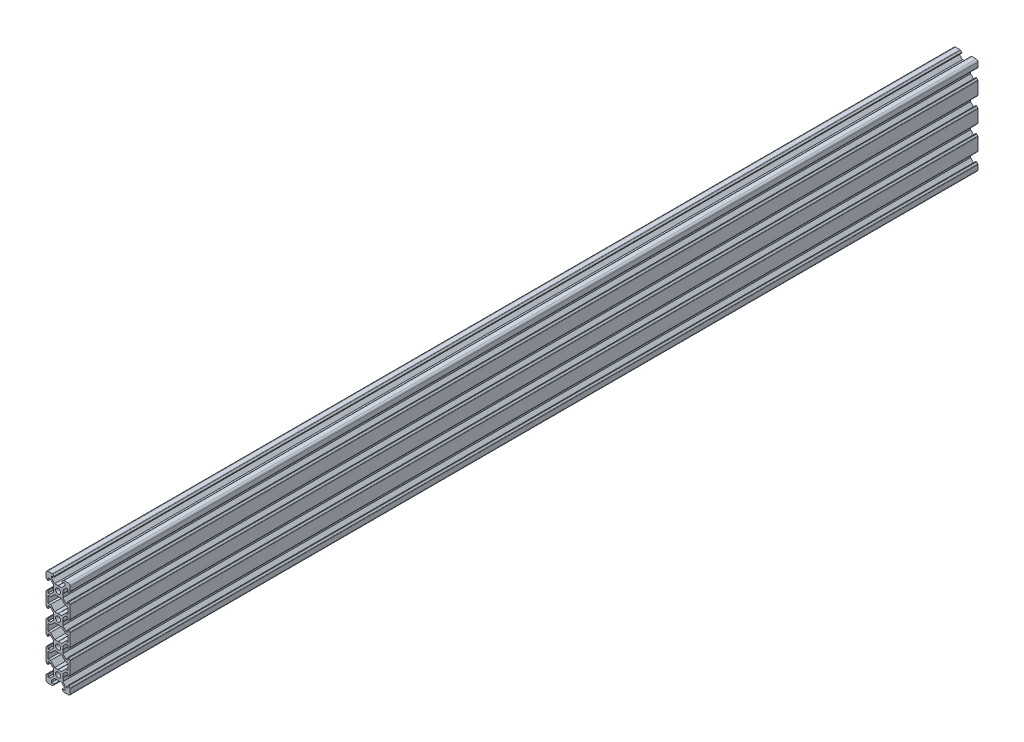
from build123d import *

# Parameters (mm, degrees)
SKETCH1_R           = 2.1
BOSS_EXTRUDE2_DEPTH = 750


with BuildPart() as part:
    # Sketch1 → Boss-Extrude2 (new body)
    with BuildSketch(Plane.XY):
        with BuildLine():
            Line((-8.5, 10), (-4.862792737, 10))
            ThreePointArc((-4.862792737, 10), (-4.598292737, 9.947387679), (-4.374060464, 9.797560464))
            Line((-4.374060464, 9.797560464), (-3.3865, 8.81))
            Line((-3.3865, 8.81), (-3.3865, 8.2))
            Line((-3.3865, 8.2), (-5.5, 8.2))
            Line((-5.5, 8.2), (-5.5, 6.561))
            Line((-5.5, 6.561), (-2.8395, 3.9005))
            Line((-2.8395, 3.9005), (-0.1, 3.9005))
            Line((-0.1, 3.9005), (0, 3.8005))
            Line((0, 3.8005), (0.1, 3.9005))
            Line((0.1, 3.9005), (2.8395, 3.9005))
            Line((2.8395, 3.9005), (5.5, 6.561))
            Line((5.5, 6.561), (5.5, 8.2))
            Line((5.5, 8.2), (3.3865, 8.2))
            Line((3.3865, 8.2), (3.3865, 8.81))
            Line((3.3865, 8.81), (4.374060464, 9.797560464))
            ThreePointArc((4.374060464, 9.797560464), (4.598292737, 9.947387679), (4.862792737, 10))
            Line((4.862792737, 10), (8.5, 10))
            ThreePointArc((8.5, 10), (9.560660172, 9.560660172), (10, 8.5))
            Line((10, 8.5), (10, 4.862792737))
            ThreePointArc((10, 4.862792737), (9.947387679, 4.598292737), (9.797560464, 4.374060464))
            Line((9.797560464, 4.374060464), (8.81, 3.3865))
            Line((8.81, 3.3865), (8.2, 3.3865))
            Line((8.2, 3.3865), (8.2, 5.5))
            Line((8.2, 5.5), (6.561, 5.5))
            Line((6.561, 5.5), (3.9005, 2.8395))
            Line((3.9005, 2.8395), (3.9005, 0.1))
            Line((3.9005, 0.1), (3.8005, 0))
            Line((3.8005, 0), (3.9005, -0.1))
            Line((3.9005, -0.1), (3.9005, -2.8395))
            Line((3.9005, -2.8395), (6.561, -5.5))
            Line((6.561, -5.5), (8.2, -5.5))
            Line((8.2, -5.5), (8.2, -3.3865))
            Line((8.2, -3.3865), (8.81, -3.3865))
            Line((8.81, -3.3865), (9.797560464, -4.374060464))
            ThreePointArc((9.797560464, -4.374060464), (9.947387679, -4.598292737), (10, -4.862792737))
            Line((10, -4.862792737), (10, -15.137207263))
            ThreePointArc((10, -15.137207263), (9.947387679, -15.401707263), (9.797560464, -15.625939536))
            Line((9.797560464, -15.625939536), (8.81, -16.6135))
            Line((8.81, -16.6135), (8.2, -16.6135))
            Line((8.2, -16.6135), (8.2, -14.5))
            Line((8.2, -14.5), (6.561, -14.5))
            Line((6.561, -14.5), (3.9005, -17.1605))
            Line((3.9005, -17.1605), (3.9005, -19.9))
            Line((3.9005, -19.9), (3.8005, -20))
            Line((3.8005, -20), (3.9005, -20.1))
            Line((3.9005, -20.1), (3.9005, -22.8395))
            Line((3.9005, -22.8395), (6.561, -25.5))
            Line((6.561, -25.5), (8.2, -25.5))
            Line((8.2, -25.5), (8.2, -23.3865))
            Line((8.2, -23.3865), (8.81, -23.3865))
            Line((8.81, -23.3865), (9.797560464, -24.374060464))
            ThreePointArc((9.797560464, -24.374060464), (9.947387679, -24.598292737), (10, -24.862792737))
            Line((10, -24.862792737), (10, -35.137207263))
            ThreePointArc((10, -35.137207263), (9.947387679, -35.401707263), (9.797560464, -35.625939536))
            Line((9.797560464, -35.625939536), (8.81, -36.6135))
            Line((8.81, -36.6135), (8.2, -36.6135))
            Line((8.2, -36.6135), (8.2, -34.5))
            Line((8.2, -34.5), (6.561, -34.5))
            Line((6.561, -34.5), (3.9005, -37.1605))
            Line((3.9005, -37.1605), (3.9005, -39.9))
            Line((3.9005, -39.9), (3.8005, -40))
            Line((3.8005, -40), (3.9005, -40.1))
            Line((3.9005, -40.1), (3.9005, -42.8395))
            Line((3.9005, -42.8395), (6.561, -45.5))
            Line((6.561, -45.5), (8.2, -45.5))
            Line((8.2, -45.5), (8.2, -43.3865))
            Line((8.2, -43.3865), (8.81, -43.3865))
            Line((8.81, -43.3865), (9.797560464, -44.374060464))
            ThreePointArc((9.797560464, -44.374060464), (9.947387679, -44.598292737), (10, -44.862792737))
            Line((10, -44.862792737), (10, -55.137207263))
            ThreePointArc((10, -55.137207263), (9.947387679, -55.401707263), (9.797560464, -55.625939536))
            Line((9.797560464, -55.625939536), (8.81, -56.6135))
            Line((8.81, -56.6135), (8.2, -56.6135))
            Line((8.2, -56.6135), (8.2, -54.5))
            Line((8.2, -54.5), (6.561, -54.5))
            Line((6.561, -54.5), (3.9005, -57.1605))
            Line((3.9005, -57.1605), (3.9005, -59.9))
            Line((3.9005, -59.9), (3.8005, -60))
            Line((3.8005, -60), (3.9005, -60.1))
            Line((3.9005, -60.1), (3.9005, -62.8395))
            Line((3.9005, -62.8395), (6.561, -65.5))
            Line((6.561, -65.5), (8.2, -65.5))
            Line((8.2, -65.5), (8.2, -63.3865))
            Line((8.2, -63.3865), (8.81, -63.3865))
            Line((8.81, -63.3865), (9.797560464, -64.374060464))
            ThreePointArc((9.797560464, -64.374060464), (9.947387679, -64.598292737), (10, -64.862792737))
            Line((10, -64.862792737), (10, -68.5))
            ThreePointArc((10, -68.5), (9.560660172, -69.560660172), (8.5, -70))
            Line((8.5, -70), (4.862792737, -70))
            ThreePointArc((4.862792737, -70), (4.598292737, -69.947387679), (4.374060464, -69.797560464))
            Line((4.374060464, -69.797560464), (3.3865, -68.81))
            Line((3.3865, -68.81), (3.3865, -68.2))
            Line((3.3865, -68.2), (5.5, -68.2))
            Line((5.5, -68.2), (5.5, -66.561))
            Line((5.5, -66.561), (2.8395, -63.9005))
            Line((2.8395, -63.9005), (0.1, -63.9005))
            Line((0.1, -63.9005), (0, -63.8005))
            Line((0, -63.8005), (-0.1, -63.9005))
            Line((-0.1, -63.9005), (-2.8395, -63.9005))
            Line((-2.8395, -63.9005), (-5.5, -66.561))
            Line((-5.5, -66.561), (-5.5, -68.2))
            Line((-5.5, -68.2), (-3.3865, -68.2))
            Line((-3.3865, -68.2), (-3.3865, -68.81))
            Line((-3.3865, -68.81), (-4.374060464, -69.797560464))
            ThreePointArc((-4.374060464, -69.797560464), (-4.598292737, -69.947387679), (-4.862792737, -70))
            Line((-4.862792737, -70), (-8.5, -70))
            ThreePointArc((-8.5, -70), (-9.560660172, -69.560660172), (-10, -68.5))
            Line((-10, -68.5), (-10, -64.862792737))
            ThreePointArc((-10, -64.862792737), (-9.947387679, -64.598292737), (-9.797560464, -64.374060464))
            Line((-9.797560464, -64.374060464), (-8.81, -63.3865))
            Line((-8.81, -63.3865), (-8.2, -63.3865))
            Line((-8.2, -63.3865), (-8.2, -65.5))
            Line((-8.2, -65.5), (-6.561, -65.5))
            Line((-6.561, -65.5), (-3.9005, -62.8395))
            Line((-3.9005, -62.8395), (-3.9005, -60.1))
            Line((-3.9005, -60.1), (-3.8005, -60))
            Line((-3.8005, -60), (-3.9005, -59.9))
            Line((-3.9005, -59.9), (-3.9005, -57.1605))
            Line((-3.9005, -57.1605), (-6.561, -54.5))
            Line((-6.561, -54.5), (-8.2, -54.5))
            Line((-8.2, -54.5), (-8.2, -56.6135))
            Line((-8.2, -56.6135), (-8.81, -56.6135))
            Line((-8.81, -56.6135), (-9.797560464, -55.625939536))
            ThreePointArc((-9.797560464, -55.625939536), (-9.947387679, -55.401707263), (-10, -55.137207263))
            Line((-10, -55.137207263), (-10, -44.862792737))
            ThreePointArc((-10, -44.862792737), (-9.947387679, -44.598292737), (-9.797560464, -44.374060464))
            Line((-9.797560464, -44.374060464), (-8.81, -43.3865))
            Line((-8.81, -43.3865), (-8.2, -43.3865))
            Line((-8.2, -43.3865), (-8.2, -45.5))
            Line((-8.2, -45.5), (-6.561, -45.5))
            Line((-6.561, -45.5), (-3.9005, -42.8395))
            Line((-3.9005, -42.8395), (-3.9005, -40.1))
            Line((-3.9005, -40.1), (-3.8005, -40))
            Line((-3.8005, -40), (-3.9005, -39.9))
            Line((-3.9005, -39.9), (-3.9005, -37.1605))
            Line((-3.9005, -37.1605), (-6.561, -34.5))
            Line((-6.561, -34.5), (-8.2, -34.5))
            Line((-8.2, -34.5), (-8.2, -36.6135))
            Line((-8.2, -36.6135), (-8.81, -36.6135))
            Line((-8.81, -36.6135), (-9.797560464, -35.625939536))
            ThreePointArc((-9.797560464, -35.625939536), (-9.947387679, -35.401707263), (-10, -35.137207263))
            Line((-10, -35.137207263), (-10, -24.862792737))
            ThreePointArc((-10, -24.862792737), (-9.947387679, -24.598292737), (-9.797560464, -24.374060464))
            Line((-9.797560464, -24.374060464), (-8.81, -23.3865))
            Line((-8.81, -23.3865), (-8.2, -23.3865))
            Line((-8.2, -23.3865), (-8.2, -25.5))
            Line((-8.2, -25.5), (-6.561, -25.5))
            Line((-6.561, -25.5), (-3.9005, -22.8395))
            Line((-3.9005, -22.8395), (-3.9005, -20.1))
            Line((-3.9005, -20.1), (-3.8005, -20))
            Line((-3.8005, -20), (-3.9005, -19.9))
            Line((-3.9005, -19.9), (-3.9005, -17.1605))
            Line((-3.9005, -17.1605), (-6.561, -14.5))
            Line((-6.561, -14.5), (-8.2, -14.5))
            Line((-8.2, -14.5), (-8.2, -16.6135))
            Line((-8.2, -16.6135), (-8.81, -16.6135))
            Line((-8.81, -16.6135), (-9.797560464, -15.625939536))
            ThreePointArc((-9.797560464, -15.625939536), (-9.947387679, -15.401707263), (-10, -15.137207263))
            Line((-10, -15.137207263), (-10, -4.862792737))
            ThreePointArc((-10, -4.862792737), (-9.947387679, -4.598292737), (-9.797560464, -4.374060464))
            Line((-9.797560464, -4.374060464), (-8.81, -3.3865))
            Line((-8.81, -3.3865), (-8.2, -3.3865))
            Line((-8.2, -3.3865), (-8.2, -5.5))
            Line((-8.2, -5.5), (-6.561, -5.5))
            Line((-6.561, -5.5), (-3.9005, -2.8395))
            Line((-3.9005, -2.8395), (-3.9005, -0.1))
            Line((-3.9005, -0.1), (-3.8005, 0))
            Line((-3.8005, 0), (-3.9005, 0.1))
            Line((-3.9005, 0.1), (-3.9005, 2.8395))
            Line((-3.9005, 2.8395), (-6.561, 5.5))
            Line((-6.561, 5.5), (-8.2, 5.5))
            Line((-8.2, 5.5), (-8.2, 3.3865))
            Line((-8.2, 3.3865), (-8.81, 3.3865))
            Line((-8.81, 3.3865), (-9.797560464, 4.374060464))
            ThreePointArc((-9.797560464, 4.374060464), (-9.947387679, 4.598292737), (-10, 4.862792737))
            Line((-10, 4.862792737), (-10, 8.5))
            ThreePointArc((-10, 8.5), (-9.560660172, 9.560660172), (-8.5, 10))
        make_face()
        Circle(SKETCH1_R, mode=Mode.SUBTRACT)
        with Locations((0, -20)):
            Circle(SKETCH1_R, mode=Mode.SUBTRACT)
        with Locations((0, -40)):
            Circle(SKETCH1_R, mode=Mode.SUBTRACT)
        with Locations((0, -60)):
            Circle(SKETCH1_R, mode=Mode.SUBTRACT)
        Polygon((-2.8395, -23.9005), (-0.1, -23.9005), (0, -23.8005), (0.1, -23.9005), (2.8395, -23.9005), (5.5, -26.561), (6.239, -27.3), (8.2, -27.3), (8.2, -32.7), (6.239, -32.7), (5.5, -33.439), (2.8395, -36.0995), (0.1, -36.0995), (0, -36.1995), (-0.1, -36.0995), (-2.8395, -36.0995), (-5.5, -33.439), (-6.239, -32.7), (-8.2, -32.7), (-8.2, -27.3), (-6.239, -27.3), (-5.5, -26.561), align=None, mode=Mode.SUBTRACT)
        Polygon((-8.2, -12.7), (-8.2, -7.3), (-6.239, -7.3), (-5.5, -6.561), (-2.8395, -3.9005), (-0.1, -3.9005), (0, -3.8005), (0.1, -3.9005), (2.8395, -3.9005), (5.5, -6.561), (6.239, -7.3), (8.2, -7.3), (8.2, -12.7), (6.239, -12.7), (5.5, -13.439), (2.8395, -16.0995), (0.1, -16.0995), (0, -16.1995), (-0.1, -16.0995), (-2.8395, -16.0995), (-5.5, -13.439), (-6.239, -12.7), align=None, mode=Mode.SUBTRACT)
        Polygon((-2.8395, -43.9005), (-0.1, -43.9005), (0, -43.8005), (0.1, -43.9005), (2.8395, -43.9005), (5.5, -46.561), (6.239, -47.3), (8.2, -47.3), (8.2, -52.7), (6.239, -52.7), (5.5, -53.439), (2.8395, -56.0995), (0.1, -56.0995), (0, -56.1995), (-0.1, -56.0995), (-2.8395, -56.0995), (-5.5, -53.439), (-6.239, -52.7), (-8.2, -52.7), (-8.2, -47.3), (-6.239, -47.3), (-5.5, -46.561), align=None, mode=Mode.SUBTRACT)
    extrude(amount=BOSS_EXTRUDE2_DEPTH)


solid = part.part
